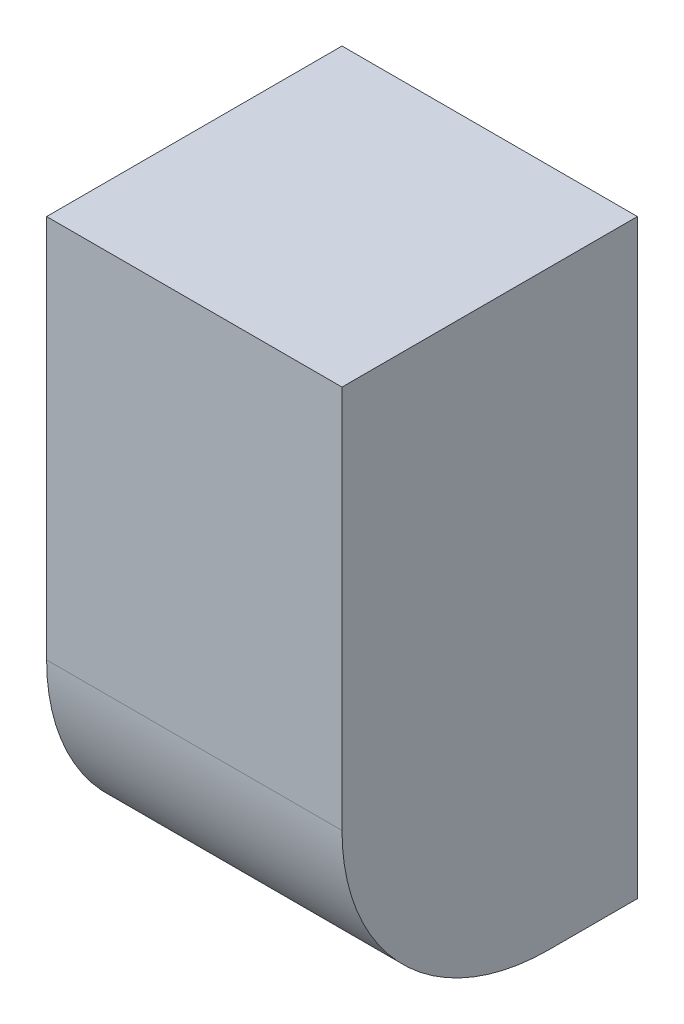
from build123d import *

# Parameters (mm, degrees)
SKETCH_1_W      = 10
SKETCH_1_H      = 20
EXTRUDE_1_DEPTH = 10
FILLET_1_R      = 7


with BuildPart() as part:
    # 草图1 → 凸台-拉伸1 (new body)
    with BuildSketch(Plane.XY):
        with Locations((-35, -30)):
            Rectangle(SKETCH_1_W, SKETCH_1_H)
    extrude(amount=EXTRUDE_1_DEPTH)

    # 圆角1
    fillet_1_edges = [part.edges().sort_by_distance(p)[0] for p in [
        (-35, -40, 10),
    ]]
    fillet(fillet_1_edges, radius=FILLET_1_R)


solid = part.part
